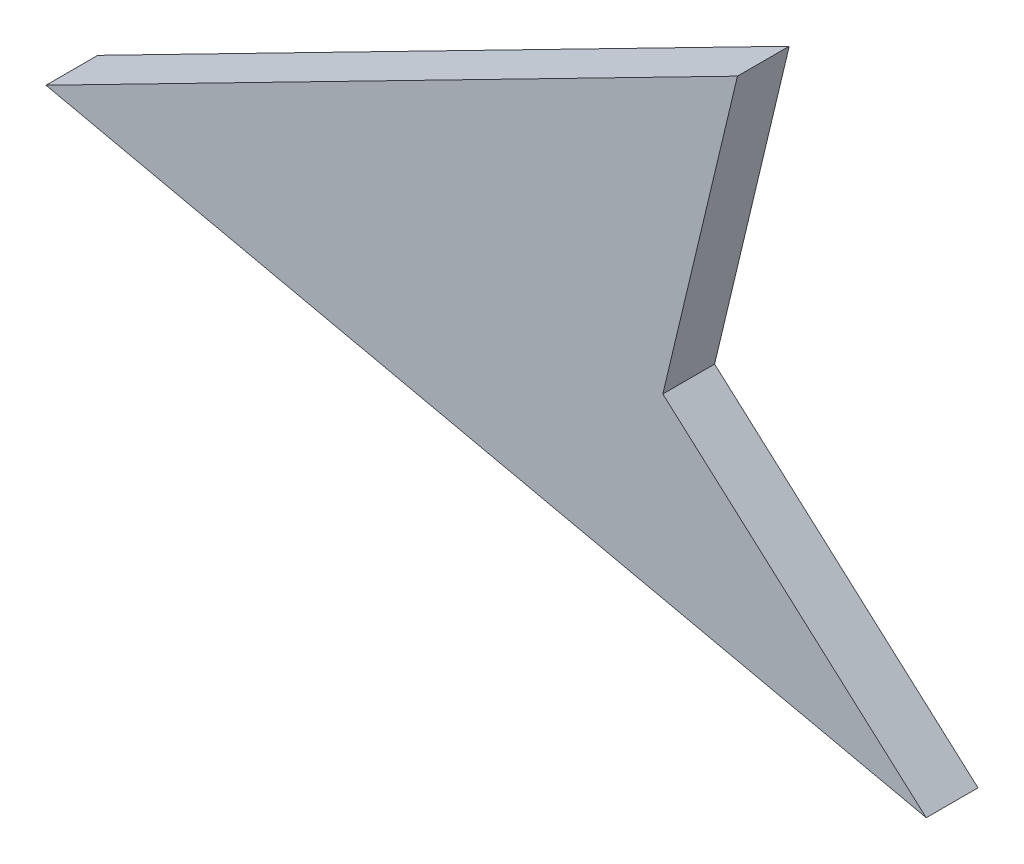
from build123d import *

# Parameters (mm, degrees)
BOSS_EXTRUDE1_DEPTH = 2


with BuildPart() as part:
    # Sketch1 → Boss-Extrude1 (new body)
    with BuildSketch(Plane.XY):
        Polygon((0, 0), (26.710065923, 13.659149988), (23.827341077, 1.58418948), (34.002189282, -7.504558598), align=None)
    extrude(amount=BOSS_EXTRUDE1_DEPTH)


solid = part.part
